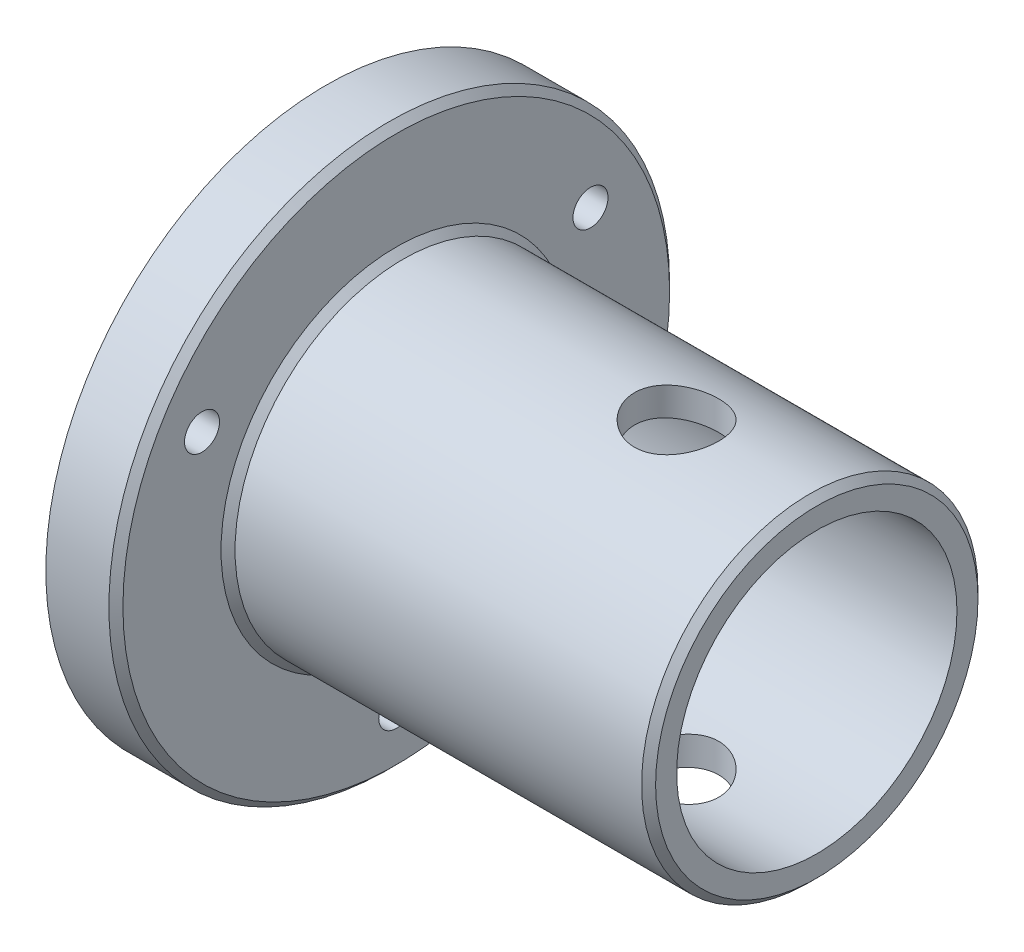
from build123d import *

# Parameters (mm, degrees)
SKETCH_1_R               = 20
EXTRUDE_1_DEPTH          = 5
M3X0_5_1_D               = 2.5
M3X0_5_1_DEPTH           = 7.5
M3X0_5_1_TIP             = 0.751075774
SKETCH_6_R               = 12
EXTRUDE_2_DEPTH          = 30
SKETCH_7_R               = 10
CUT_EXTRUDE_2_DEPTH      = 30
CHAMFER_1_SIZE           = 0.5
CUT_EXTRUDE_3_DEPTH      = 46
CUT_EXTRUDE_3_DEPTH_BACK = 46
SKETCH_8_R               = 3
CHAMFER_2_SIZE           = 0.5
CHAMFER_3_SIZE           = 0.5


with BuildPart() as part:
    # 草图1 → 凸台-拉伸1 (new body)
    with BuildSketch(Plane(origin=(0, 0, 0), x_dir=(0, 0, -1), z_dir=(1, 0, 0))):
        Circle(SKETCH_1_R)
    extrude(amount=EXTRUDE_1_DEPTH)

    # M3x0.5 螺纹孔1
    with Locations(Plane.ZY):
        with Locations((-13.856406461, 8), (13.856406461, 8), (0, -16)):
            Hole(M3X0_5_1_D / 2, depth=M3X0_5_1_DEPTH)
            with Locations((0, 0, -(M3X0_5_1_DEPTH + M3X0_5_1_TIP / 2))):  # 118° drill point
                Cone(0, M3X0_5_1_D / 2, M3X0_5_1_TIP, mode=Mode.SUBTRACT)

    # 草图6 → 凸台-拉伸2 (add)
    with BuildSketch(Plane(origin=(5, 0, 0), x_dir=(0, 0, -1), z_dir=(1, 0, 0))):
        Circle(SKETCH_6_R)
    extrude(amount=EXTRUDE_2_DEPTH)

    # 草图7 → 切除-拉伸2 (cut)
    with BuildSketch(Plane(origin=(35, 0, 0), x_dir=(0, 0, -1), z_dir=(1, 0, 0))):
        Circle(SKETCH_7_R)
    extrude(amount=-CUT_EXTRUDE_2_DEPTH, mode=Mode.SUBTRACT)

    # 倒角1
    chamfer_1_edges = [part.edges().sort_by_distance(p)[0] for p in [
        (35, 0, 12),
    ]]
    chamfer(chamfer_1_edges, length=CHAMFER_1_SIZE)

    # 草图8 → 切除-拉伸3 (cut, two sides: drawn at the far end of the back side and taken through both)
    with BuildSketch(Plane(origin=(0, 0, 0), x_dir=(1, 0, 0), z_dir=(0, 1, 0)).offset(-CUT_EXTRUDE_3_DEPTH_BACK)):
        with Locations(Location((25, 0, 0), (0, 0, 90))):
            Circle(SKETCH_8_R)
    extrude(amount=CUT_EXTRUDE_3_DEPTH + CUT_EXTRUDE_3_DEPTH_BACK, mode=Mode.SUBTRACT)

    # 倒角2
    chamfer_2_edges = [part.edges().sort_by_distance(p)[0] for p in [
        (5, 0, 20),
    ]]
    chamfer(chamfer_2_edges, length=CHAMFER_2_SIZE)

    # 倒角3
    chamfer_3_edges = [part.edges().sort_by_distance(p)[0] for p in [
        (5, 0, 12),
    ]]
    chamfer(chamfer_3_edges, length=CHAMFER_3_SIZE)


solid = part.part
